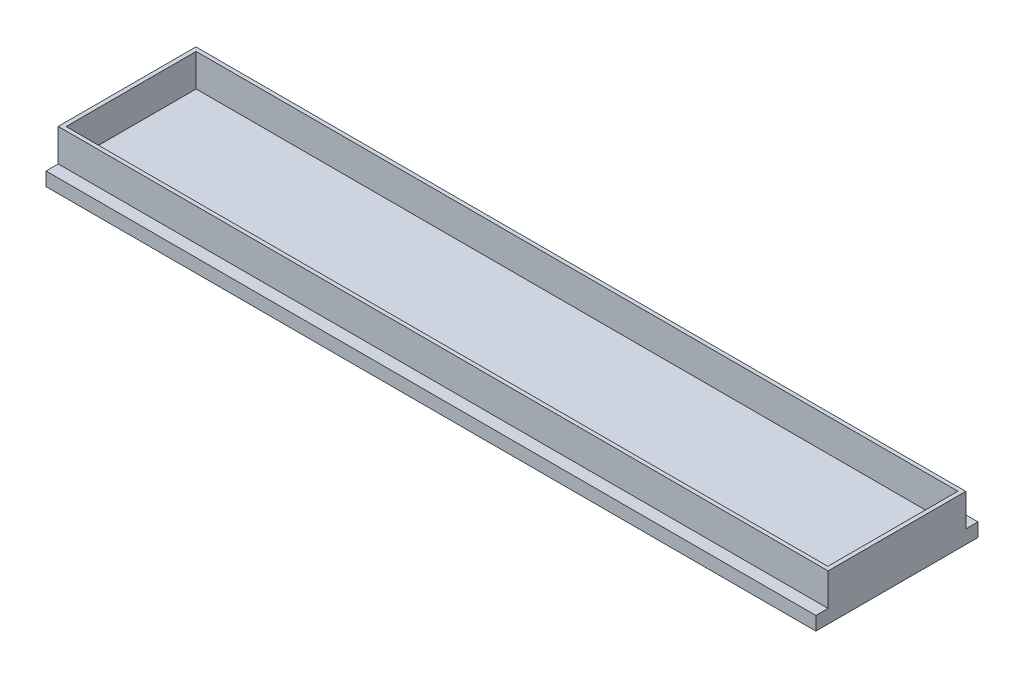
from build123d import *

# Parameters (mm, degrees)
SKETCH2_W           = 1420
SKETCH2_H           = 299
BOSS_EXTRUDE1_DEPTH = 25
SKETCH3_W           = 1420
SKETCH3_H           = 254
SKETCH3_W_2         = 1405
SKETCH3_H_2         = 240
BOSS_EXTRUDE2_DEPTH = 60


with BuildPart() as part:
    # Sketch2 → Boss-Extrude1 (new body)
    with BuildSketch(Plane(origin=(0, 0, 0), x_dir=(1, 0, 0), z_dir=(0, 1, 0))):
        Rectangle(SKETCH2_W, SKETCH2_H)
    extrude(amount=BOSS_EXTRUDE1_DEPTH)

    # Sketch3 → Boss-Extrude2 (add)
    with BuildSketch(Plane(origin=(0, 25, 0), x_dir=(1, 0, 0), z_dir=(0, 1, 0))):
        Rectangle(SKETCH3_W, SKETCH3_H)
        Rectangle(SKETCH3_W_2, SKETCH3_H_2, mode=Mode.SUBTRACT)
    extrude(amount=BOSS_EXTRUDE2_DEPTH)


solid = part.part
